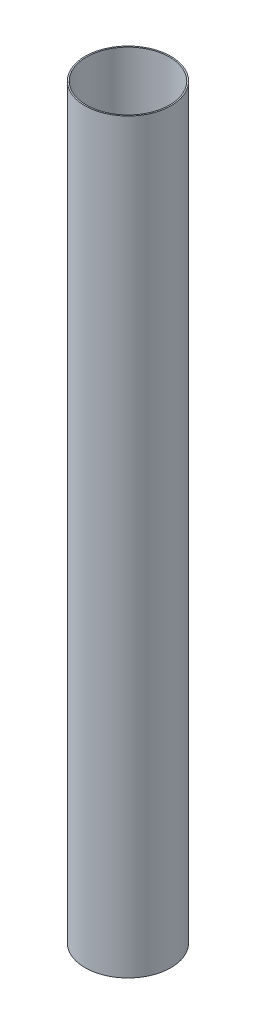
from build123d import *

# Parameters (mm, degrees)
SKETCH1_R           = 51.1048
SKETCH1_R_2         = 49.53
BOSS_EXTRUDE1_DEPTH = 889


with BuildPart() as part:
    # Sketch1 → Boss-Extrude1 (new body)
    with BuildSketch(Plane(origin=(0, 0, 0), x_dir=(1, 0, 0), z_dir=(0, 1, 0))):
        with Locations(Location((0, 0, 0), (0, 0, 270))):
            Circle(SKETCH1_R)
        with Locations(Location((0, 0, 0), (0, 0, 270))):
            Circle(SKETCH1_R_2, mode=Mode.SUBTRACT)
    extrude(amount=BOSS_EXTRUDE1_DEPTH)


solid = part.part
